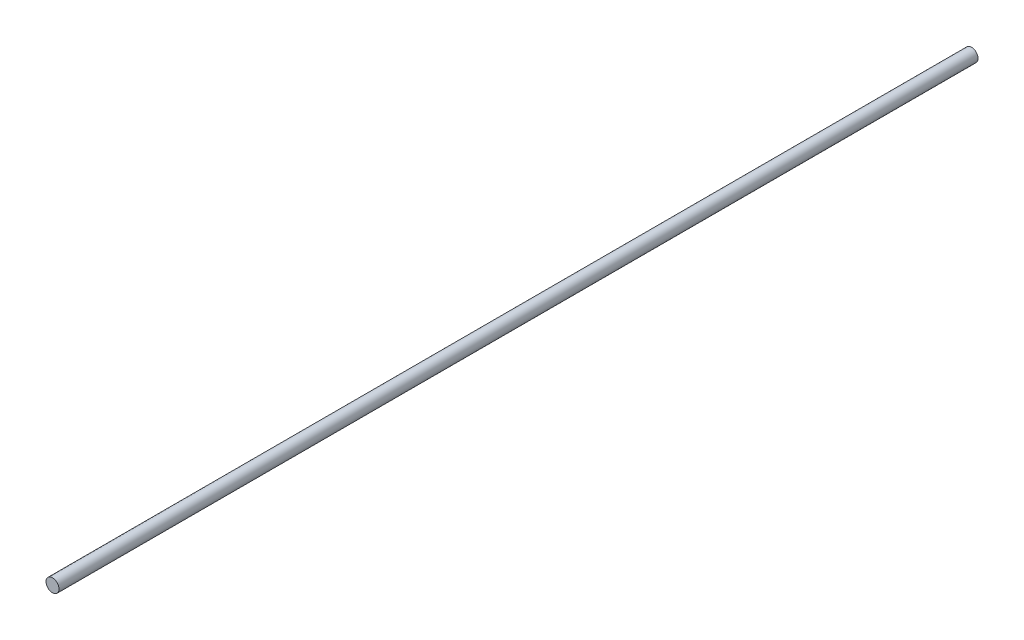
from build123d import *

# Parameters (mm, degrees)
SKETCH4_R           = 6.35
BOSS_EXTRUDE1_DEPTH = 898.39481138


with BuildPart() as part:
    # Sketch4 → Boss-Extrude1 (new body)
    with BuildSketch(Plane.XY):
        with Locations(Location((0, 0, 0), (0, 0, 180))):
            Circle(SKETCH4_R)
    extrude(amount=BOSS_EXTRUDE1_DEPTH)


solid = part.part
